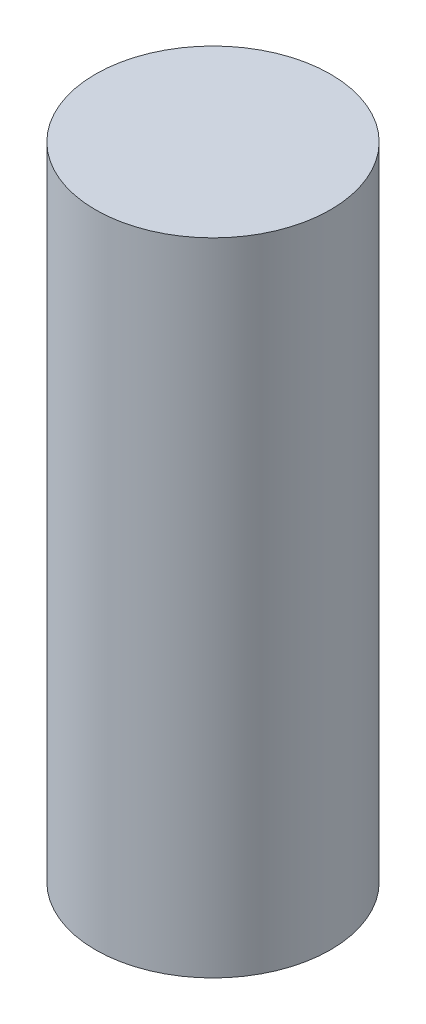
from build123d import *

# Parameters (mm, degrees)
SKETCH1_R           = 2.75
BOSS_EXTRUDE1_DEPTH = 15


with BuildPart() as part:
    # Sketch1 → Boss-Extrude1 (new body)
    with BuildSketch(Plane(origin=(0, 0, 0), x_dir=(1, 0, 0), z_dir=(0, 1, 0))):
        with Locations(Location((0, 0, 0), (0, 0, 270))):
            Circle(SKETCH1_R)
    extrude(amount=BOSS_EXTRUDE1_DEPTH)


solid = part.part
